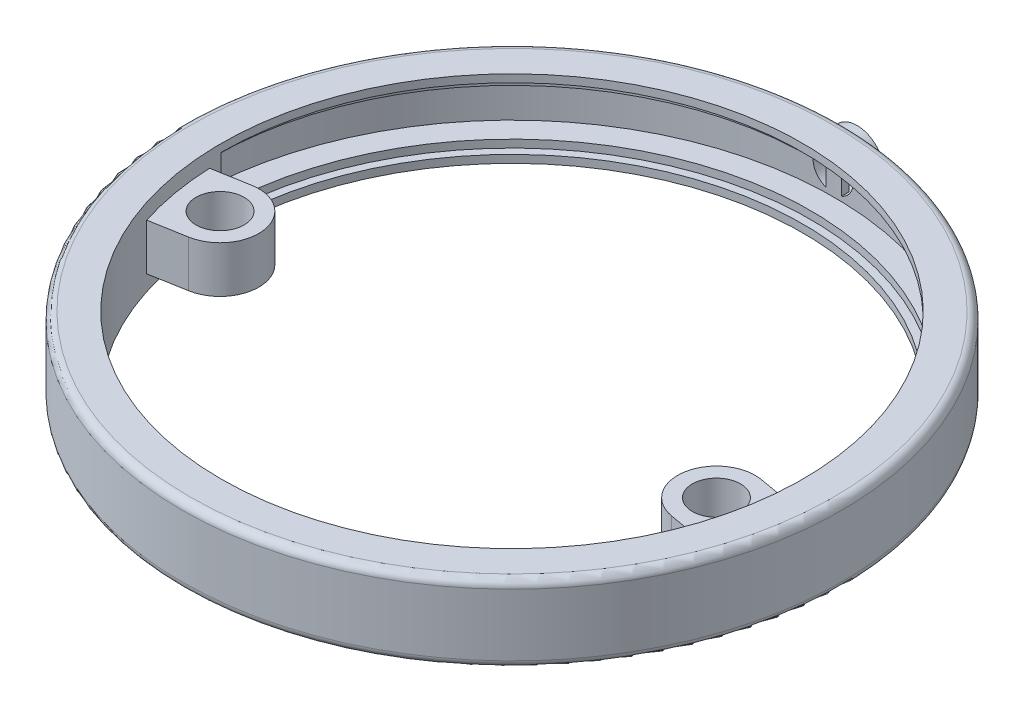
from build123d import *
from build123d.topology import SkipClean

# Parameters (mm, degrees)
REVOLVE_1_ANGLE      = 180
REVOLVE_2_ANGLE      = 180
EXTRUDE_5_DEPTH      = 3
EXTRUDE_5_DEPTH_BACK = 3
SKETCH_4_R           = 3.1
SKETCH_4_W           = 10
SKETCH_4_H           = 4
CUT_EXTRUDE_1_DEPTH  = 95.478833653
EXTRUDE_6_DEPTH      = 1
EXTRUDE_6_DEPTH_BACK = 2
SKETCH_6_R           = 3.5
SKETCH_6_R_2         = 2.6


with BuildPart() as part:
    # 草图1 → 旋转1 (revolve)
    with BuildSketch(Plane.XY):
        with BuildLine():
            Line((3, 6), (3, 7))
            Line((3, 7), (4, 7))
            Line((4, 7), (4, 8))
            Line((4, 8), (1.5, 8))
            Line((1.5, 8), (0, 8))
            ThreePointArc((0, 8), (-0.707106781, 7.707106781), (-1, 7))
            Line((-1, 7), (-1, -1))
            ThreePointArc((-1, -1), (-0.707106781, -1.707106781), (0, -2))
            Line((0, -2), (1.5, -2))
            Line((1.5, -2), (4, -2))
            Line((4, -2), (4, -1))
            Line((4, -1), (3, -1))
            Line((3, -1), (3, 0))
            Line((3, 0), (0, 0))
            Line((0, 0), (0, 6))
            Line((0, 6), (3, 6))
        make_face()
    revolve(axis=Axis((41.5, 14.191636994, 0), (0, -1, 0)), revolution_arc=REVOLVE_1_ANGLE)

    # 草图2 → 旋转2 (revolve)
    with SkipClean():  # the faces are left unmerged after this step: merging them gives an invalid solid
        with BuildSketch(Plane.XY):
            with BuildLine():
                Line((0, -2), (4, -2))
                Line((4, -2), (4, 8))
                Line((4, 8), (0, 8))
                ThreePointArc((0, 8), (-0.707106781, 7.707106781), (-1, 7))
                Line((-1, 7), (-1, -1))
                ThreePointArc((-1, -1), (-0.707106781, -1.707106781), (0, -2))
            make_face()
        revolve(axis=Axis((41.5, 14.191636994, 0), (0, 1, 0)), revolution_arc=REVOLVE_2_ANGLE)

    # 草图4 → 凸台-拉伸5 (add, two sides: drawn at the far end of the back side and taken through both)
    # profile 1 of 3: a face of its own
    with SkipClean():  # the faces are left unmerged after this step: merging them gives an invalid solid
        with BuildSketch(Plane(origin=(0, 3, 0), x_dir=(-1, 0, 0), z_dir=(0, -1, 0)).offset(-EXTRUDE_5_DEPTH_BACK)):
            with BuildLine():
                Line((-3.701468374, -1.587767897), (-5.43795015, -11.435845428))
                Line((-5.43795015, -11.435845428), (-10.361988915, -10.567604539))
                ThreePointArc((-10.361988915, -10.567604539), (-14.417786792, -4.775324886), (-8.625507139, -0.719527009))
                Line((-8.625507139, -0.719527009), (-3.701468374, -1.587767897))
            make_face()
            with Locations((-9.493748027, -5.643565774)):
                Circle(SKETCH_4_R, mode=Mode.SUBTRACT)
        # profile 2 of 3: a face of its own
        with BuildSketch(Plane(origin=(0, 3, 0), x_dir=(-1, 0, 0), z_dir=(0, -1, 0)).offset(-EXTRUDE_5_DEPTH_BACK)):
            with BuildLine():
                Line((-77.56204985, -11.435845428), (-79.298531626, -1.587767897))
                Line((-79.298531626, -1.587767897), (-74.374492861, -0.719527009))
                ThreePointArc((-74.374492861, -0.719527009), (-68.582213208, -4.775324886), (-72.638011085, -10.567604539))
                Line((-72.638011085, -10.567604539), (-77.56204985, -11.435845428))
            make_face()
            with Locations((-73.506251973, -5.643565774)):
                Circle(SKETCH_4_R, mode=Mode.SUBTRACT)
        # profile 3 of 3: a face of its own
        with BuildSketch(Plane(origin=(0, 3, 0), x_dir=(-1, 0, 0), z_dir=(0, -1, 0)).offset(-EXTRUDE_5_DEPTH_BACK)):
            with Locations((-41.5, -37.5)):
                Rectangle(SKETCH_4_W, SKETCH_4_H)
        extrude(amount=EXTRUDE_5_DEPTH + EXTRUDE_5_DEPTH_BACK)

    # 草图5 → 切除-拉伸1 (cut, through all)
    with SkipClean():  # the faces are left unmerged after this step: merging them gives an invalid solid
        with BuildSketch(Plane.XY):
            with BuildLine():
                Line((40.5, 5.4), (40.5, 0.6))
                ThreePointArc((40.5, 0.6), (38.9, 3), (40.5, 5.4))
            make_face()
            with BuildLine():
                Line((42.5, 5.4), (42.5, 0.6))
                ThreePointArc((42.5, 0.6), (44.1, 3), (42.5, 5.4))
            make_face()
        extrude(amount=-CUT_EXTRUDE_1_DEPTH, mode=Mode.SUBTRACT)

    # 草图6 → 凸台-拉伸6 (add, two sides: drawn at the far end of the back side and taken through both)
    with SkipClean():  # the faces are left unmerged after this step: merging them gives an invalid solid
        with BuildSketch(Plane.XY.offset(-42.5).offset(-EXTRUDE_6_DEPTH_BACK)):
            with Locations((41.5, 3)):
                Circle(SKETCH_6_R)
            with Locations((41.5, 3)):
                Circle(SKETCH_6_R_2, mode=Mode.SUBTRACT)
        extrude(amount=EXTRUDE_6_DEPTH + EXTRUDE_6_DEPTH_BACK)


solid = part.part
